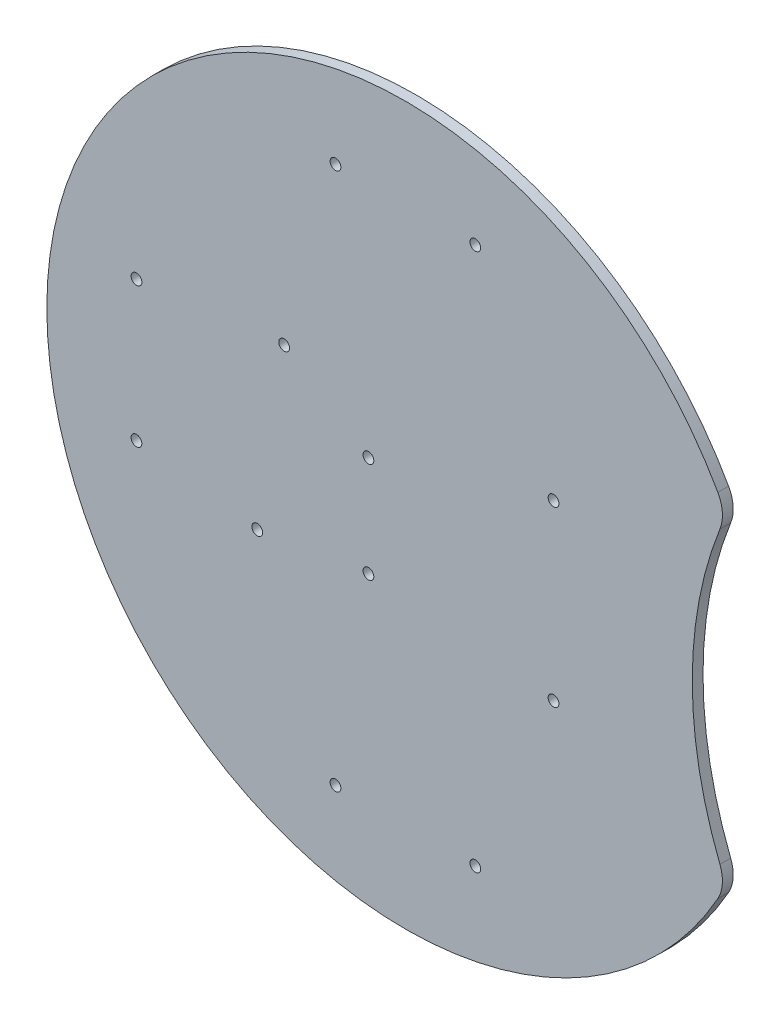
from build123d import *

# Parameters (mm, degrees)
CROQUIS1_R              = 100
SALIENTE_EXTRUIR1_DEPTH = 3
CROQUIS3_R              = 110
CORTAR_EXTRUIR1_DEPTH   = 3
REDONDEO1_R             = 10
CROQUIS4_R              = 1.5
CORTAR_EXTRUIR2_DEPTH   = 142.453172607
CROQUIS5_R              = 1.5
CORTAR_EXTRUIR3_DEPTH   = 142.453172607


with BuildPart() as part:
    # Croquis1 → Saliente-Extruir1 (new body)
    with BuildSketch(Plane.XY):
        Circle(CROQUIS1_R)
    extrude(amount=SALIENTE_EXTRUIR1_DEPTH)

    # Croquis3 → Cortar-Extruir1 (cut)
    with BuildSketch(Plane.XY.offset(3)):
        with Locations((190, 0)):
            Circle(CROQUIS3_R)
    extrude(amount=-CORTAR_EXTRUIR1_DEPTH, mode=Mode.SUBTRACT)

    # Redondeo1
    redondeo1_edges = [part.edges().sort_by_distance(p)[0] for p in [
        (89.473684211, -44.659375654, 1.5),
        (89.473684211, 44.659375654, 1.5),
    ]]
    fillet(redondeo1_edges, radius=REDONDEO1_R)

    # Croquis4 → Cortar-Extruir2 (cut, through all)
    with BuildSketch(Plane.XY.offset(3)):
        with Locations((-33.815, 24.17)):
            Circle(CROQUIS4_R)
        with Locations((-41.315, -24.17)):
            Circle(CROQUIS4_R)
        with Locations((41.315, -24.17)):
            Circle(CROQUIS4_R)
        with Locations((41.315, 24.17)):
            Circle(CROQUIS4_R)
        with Locations((-10.31559482, -19.297497716)):
            Circle(CROQUIS4_R)
        with Locations((-10.311195262, 8.714642909)):
            Circle(CROQUIS4_R)
    extrude(amount=-CORTAR_EXTRUIR2_DEPTH, mode=Mode.SUBTRACT)

    # Croquis5 → Cortar-Extruir3 (cut, through all)
    with BuildSketch(Plane.XY.offset(3)):
        with Locations((-75, 19.5)):
            Circle(CROQUIS5_R)
        with Locations((-75, -19.5)):
            Circle(CROQUIS5_R)
        with Locations((19.5, 75)):
            Circle(CROQUIS5_R)
        with Locations((-19.5, 75)):
            Circle(CROQUIS5_R)
        with Locations((-19.5, -75)):
            Circle(CROQUIS5_R)
        with Locations((19.5, -75)):
            Circle(CROQUIS5_R)
    extrude(amount=-CORTAR_EXTRUIR3_DEPTH, mode=Mode.SUBTRACT)


solid = part.part
